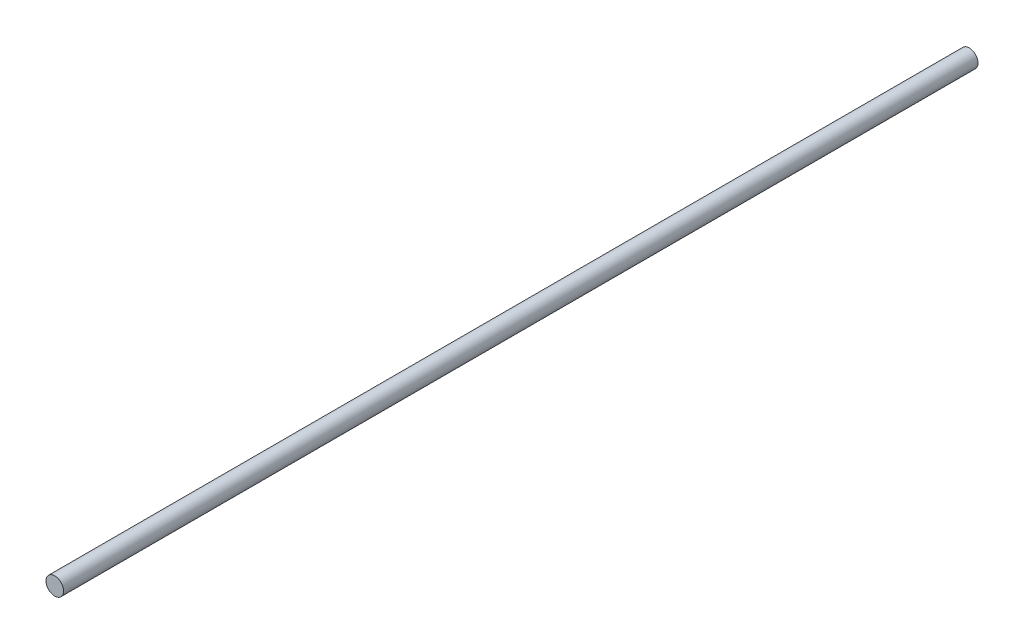
from build123d import *

# Parameters (mm, degrees)
SKETCH1_R           = 5.55625
BOSS_EXTRUDE1_DEPTH = 288.925


with BuildPart() as part:
    # Sketch1 → Boss-Extrude1 (new, symmetric)
    with BuildSketch(Plane.XY):
        Circle(SKETCH1_R)
    extrude(amount=BOSS_EXTRUDE1_DEPTH, both=True)


solid = part.part
